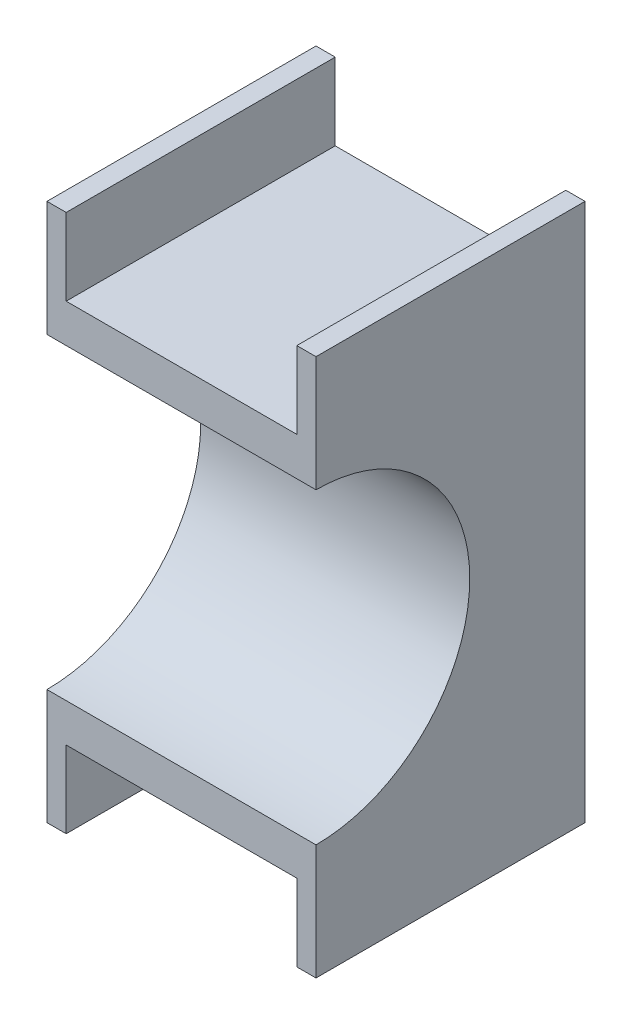
from build123d import *

# Parameters (mm, degrees)
ESQUISSE1_W             = 3.5
ESQUISSE1_H             = 7
BOSS_EXTRU_1_DEPTH      = 3.5
ESQUISSE2_W             = 3
ESQUISSE2_H             = 3.5
ENL_V_MAT_EXTRU_1_DEPTH = 1
ESQUISSE3_W             = 3
ESQUISSE3_H             = 3.5
ENL_V_MAT_EXTRU_2_DEPTH = 1
ENL_V_MAT_EXTRU_4_DEPTH = 10


with BuildPart() as part:
    # Esquisse1 → Boss.-Extru.1 (new body)
    with BuildSketch(Plane.XY):
        with Locations((0.25, 0)):
            Rectangle(ESQUISSE1_W, ESQUISSE1_H)
    extrude(amount=BOSS_EXTRU_1_DEPTH)

    # Esquisse2 → Enlèv. mat.-Extru.1 (cut)
    with BuildSketch(Plane(origin=(0, 3.5, 0), x_dir=(1, 0, 0), z_dir=(0, 1, 0))):
        with Locations((0.25, -1.75)):
            Rectangle(ESQUISSE2_W, ESQUISSE2_H)
    extrude(amount=-ENL_V_MAT_EXTRU_1_DEPTH, mode=Mode.SUBTRACT)

    # Esquisse3 → Enlèv. mat.-Extru.2 (cut)
    with BuildSketch(Plane(origin=(0, -3.5, 0), x_dir=(-1, 0, 0), z_dir=(0, -1, 0))):
        with Locations((-0.25, -1.75)):
            Rectangle(ESQUISSE3_W, ESQUISSE3_H)
    extrude(amount=-ENL_V_MAT_EXTRU_2_DEPTH, mode=Mode.SUBTRACT)

    # Esquisse5 → Enlèv. mat.-Extru.4 (cut)
    with BuildSketch(Plane(origin=(2, 0, 0), x_dir=(0, 0, -1), z_dir=(1, 0, 0))):
        with BuildLine():
            Line((-3.5, -2), (-3.5, 2))
            ThreePointArc((-3.5, 2), (-1.5, 0), (-3.5, -2))
        make_face()
    extrude(amount=-ENL_V_MAT_EXTRU_4_DEPTH, mode=Mode.SUBTRACT)


solid = part.part
